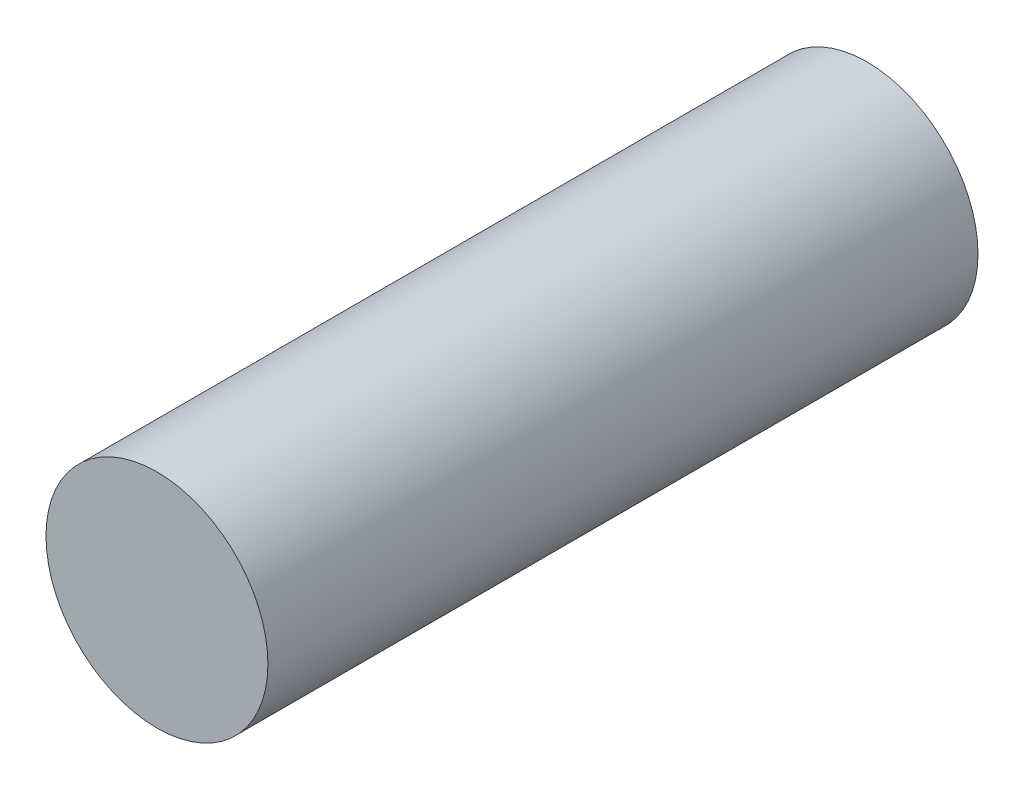
from build123d import *

# Parameters (mm, degrees)
SCHIZZO1_R                   = 3.75
ESTRUSIONE_ESTRUSIONE1_DEPTH = 24


with BuildPart() as part:
    # Schizzo1 → Estrusione-Estrusione1 (new body)
    with BuildSketch(Plane.XY):
        Circle(SCHIZZO1_R)
    extrude(amount=-ESTRUSIONE_ESTRUSIONE1_DEPTH)


solid = part.part
